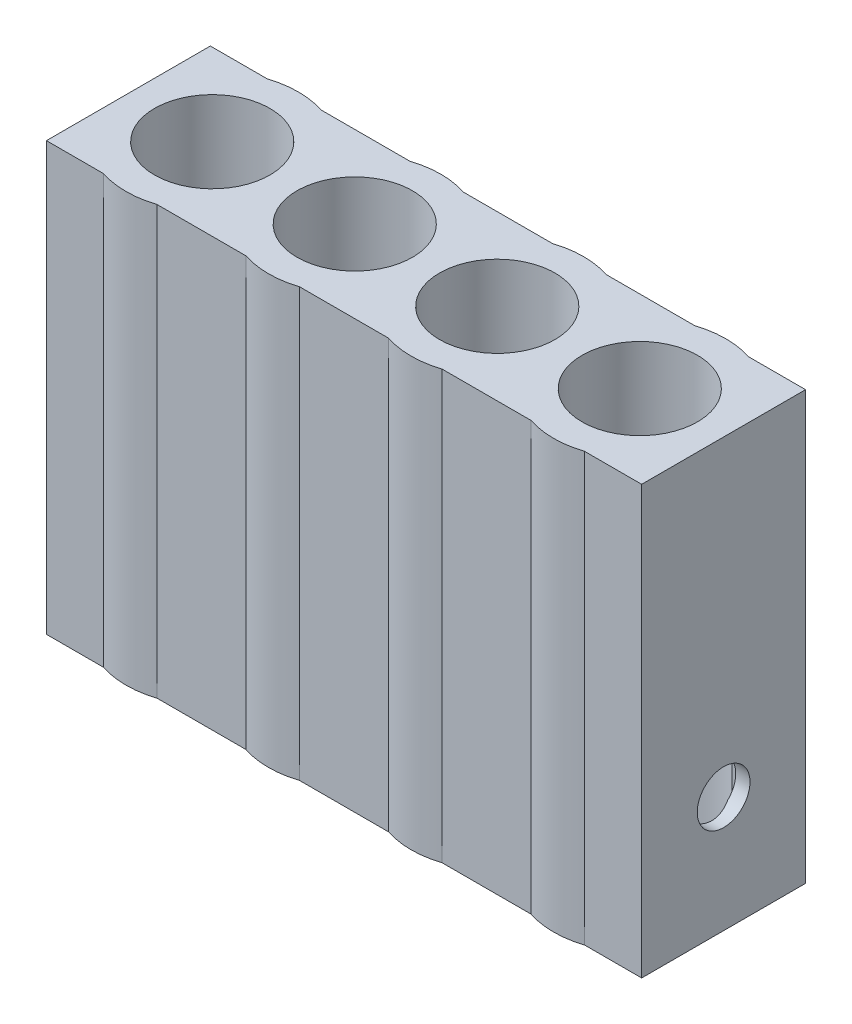
from build123d import *

# Parameters (mm, degrees)
BOSS_EXTRUDE2_DEPTH = 300
CUT_EXTRUDE1_DEPTH  = 200
SKETCH4_R           = 18.503
CUT_EXTRUDE2_DEPTH  = 500
CUT_EXTRUDE3_DEPTH  = 300


with BuildPart() as part:
    # Sketch1 → Boss-Extrude2 (new body)
    with BuildSketch(Plane(origin=(0, 0, 0), x_dir=(1, 0, 0), z_dir=(0, 1, 0))):
        with BuildLine():
            ThreePointArc((39.9, 6.945502142), (43.30489778, 21.11670865), (50, 34.062442661))
            ThreePointArc((50, 34.062442661), (36.348342006, 48.363705745), (18.814887722, 57.5))
            Line((18.814887722, 57.5), (0, 57.5))
            Line((0, 57.5), (0, 40.5))
            ThreePointArc((0, 40.5), (26.066809963, 30.99631298), (39.9, 6.945502142))
        make_face()
        with BuildLine():
            ThreePointArc((0, -40.5), (-40.5, 0), (0, 40.5))
            Line((0, 40.5), (0, 57.5))
            Line((0, 57.5), (-18.814887722, 57.5))
            ThreePointArc((-18.814887722, 57.5), (-44.4487457, 41.04337956), (-58.814340786, 14.181795299))
            Line((-58.814340786, 14.181795299), (-58.814340786, -14.181795299))
            ThreePointArc((-58.814340786, -14.181795299), (-44.4487457, -41.04337956), (-18.814887722, -57.5))
            Line((-18.814887722, -57.5), (0, -57.5))
            Line((0, -57.5), (0, -40.5))
        make_face()
        with BuildLine():
            ThreePointArc((18.814887722, -57.5), (36.348342006, -48.363705745), (50, -34.062442661))
            ThreePointArc((50, -34.062442661), (43.30489778, -21.11670865), (39.9, -6.945502142))
            ThreePointArc((39.9, -6.945502142), (26.066809963, -30.99631298), (0, -40.5))
            Line((0, -40.5), (0, -57.5))
            Line((0, -57.5), (18.814887722, -57.5))
        make_face()
        with BuildLine():
            ThreePointArc((60.1, -6.945502142), (59.650278811, -3.485685012), (59.5, 0))
            Line((59.5, 0), (40.5, 0))
            ThreePointArc((40.5, 0), (40.349721189, -3.485685012), (39.9, -6.945502142))
            ThreePointArc((39.9, -6.945502142), (43.30489778, -21.11670865), (50, -34.062442661))
            ThreePointArc((50, -34.062442661), (56.69510222, -21.11670865), (60.1, -6.945502142))
        make_face()
        with BuildLine():
            Line((40.5, 0), (59.5, 0))
            ThreePointArc((59.5, 0), (59.650278811, 3.485685012), (60.1, 6.945502142))
            ThreePointArc((60.1, 6.945502142), (56.69510222, 21.11670865), (50, 34.062442661))
            ThreePointArc((50, 34.062442661), (43.30489778, 21.11670865), (39.9, 6.945502142))
            ThreePointArc((39.9, 6.945502142), (40.349721189, 3.485685012), (40.5, 0))
        make_face()
        with BuildLine():
            ThreePointArc((139.9, -6.945502142), (100, -40.5), (60.1, -6.945502142))
            ThreePointArc((60.1, -6.945502142), (56.69510222, -21.11670865), (50, -34.062442661))
            ThreePointArc((50, -34.062442661), (63.651657994, -48.363705745), (81.185112278, -57.5))
            Line((81.185112278, -57.5), (118.814887722, -57.5))
            ThreePointArc((118.814887722, -57.5), (136.348342006, -48.363705745), (150, -34.062442661))
            ThreePointArc((150, -34.062442661), (143.30489778, -21.11670865), (139.9, -6.945502142))
        make_face()
        with BuildLine():
            ThreePointArc((50, 34.062442661), (56.69510222, 21.11670865), (60.1, 6.945502142))
            ThreePointArc((60.1, 6.945502142), (100, 40.5), (139.9, 6.945502142))
            ThreePointArc((139.9, 6.945502142), (143.30489778, 21.11670865), (150, 34.062442661))
            ThreePointArc((150, 34.062442661), (136.348342006, 48.363705745), (118.814887722, 57.5))
            Line((118.814887722, 57.5), (81.185112278, 57.5))
            ThreePointArc((81.185112278, 57.5), (63.651657994, 48.363705745), (50, 34.062442661))
        make_face()
        with BuildLine():
            ThreePointArc((150, 34.062442661), (143.30489778, 21.11670865), (139.9, 6.945502142))
            ThreePointArc((139.9, 6.945502142), (140.349721189, 3.485685012), (140.5, 0))
            Line((140.5, 0), (159.5, 0))
            ThreePointArc((159.5, 0), (159.650278811, 3.485685012), (160.1, 6.945502142))
            ThreePointArc((160.1, 6.945502142), (156.69510222, 21.11670865), (150, 34.062442661))
        make_face()
        with BuildLine():
            ThreePointArc((140.5, 0), (140.349721189, -3.485685012), (139.9, -6.945502142))
            ThreePointArc((139.9, -6.945502142), (143.30489778, -21.11670865), (150, -34.062442661))
            ThreePointArc((150, -34.062442661), (156.69510222, -21.11670865), (160.1, -6.945502142))
            ThreePointArc((160.1, -6.945502142), (159.650278811, -3.485685012), (159.5, 0))
            Line((159.5, 0), (140.5, 0))
        make_face()
        with BuildLine():
            ThreePointArc((181.185112278, 57.5), (163.651657994, 48.363705745), (150, 34.062442661))
            ThreePointArc((150, 34.062442661), (156.69510222, 21.11670865), (160.1, 6.945502142))
            ThreePointArc((160.1, 6.945502142), (200, 40.5), (239.9, 6.945502142))
            ThreePointArc((239.9, 6.945502142), (243.30489778, 21.11670865), (250, 34.062442661))
            ThreePointArc((250, 34.062442661), (236.348342006, 48.363705745), (218.814887722, 57.5))
            Line((218.814887722, 57.5), (181.185112278, 57.5))
        make_face()
        with BuildLine():
            ThreePointArc((160.1, -6.945502142), (156.69510222, -21.11670865), (150, -34.062442661))
            ThreePointArc((150, -34.062442661), (163.651657994, -48.363705745), (181.185112278, -57.5))
            Line((181.185112278, -57.5), (218.814887722, -57.5))
            ThreePointArc((218.814887722, -57.5), (236.348342006, -48.363705745), (250, -34.062442661))
            ThreePointArc((250, -34.062442661), (243.30489778, -21.11670865), (239.9, -6.945502142))
            ThreePointArc((239.9, -6.945502142), (200, -40.5), (160.1, -6.945502142))
        make_face()
        with BuildLine():
            ThreePointArc((250, 34.062442661), (243.30489778, 21.11670865), (239.9, 6.945502142))
            ThreePointArc((239.9, 6.945502142), (240.349721189, 3.485685012), (240.5, 0))
            Line((240.5, 0), (259.5, 0))
            ThreePointArc((259.5, 0), (259.650278811, 3.485685012), (260.1, 6.945502142))
            ThreePointArc((260.1, 6.945502142), (256.69510222, 21.11670865), (250, 34.062442661))
        make_face()
        with BuildLine():
            ThreePointArc((240.5, 0), (240.349721189, -3.485685012), (239.9, -6.945502142))
            ThreePointArc((239.9, -6.945502142), (243.30489778, -21.11670865), (250, -34.062442661))
            ThreePointArc((250, -34.062442661), (256.69510222, -21.11670865), (260.1, -6.945502142))
            ThreePointArc((260.1, -6.945502142), (259.650278811, -3.485685012), (259.5, 0))
            Line((259.5, 0), (240.5, 0))
        make_face()
        with BuildLine():
            ThreePointArc((281.185112278, 57.5), (263.651657994, 48.363705745), (250, 34.062442661))
            ThreePointArc((250, 34.062442661), (256.69510222, 21.11670865), (260.1, 6.945502142))
            ThreePointArc((260.1, 6.945502142), (273.933190037, 30.99631298), (300, 40.5))
            Line((300, 40.5), (300, 57.5))
            Line((300, 57.5), (281.185112278, 57.5))
        make_face()
        with BuildLine():
            ThreePointArc((260.1, -6.945502142), (256.69510222, -21.11670865), (250, -34.062442661))
            ThreePointArc((250, -34.062442661), (263.651657994, -48.363705745), (281.185112278, -57.5))
            Line((281.185112278, -57.5), (300, -57.5))
            Line((300, -57.5), (318.814887722, -57.5))
            ThreePointArc((318.814887722, -57.5), (344.4487457, -41.04337956), (358.814340786, -14.181795299))
            Line((358.814340786, -14.181795299), (358.814340786, 14.181795299))
            ThreePointArc((358.814340786, 14.181795299), (344.4487457, 41.04337956), (318.814887722, 57.5))
            Line((318.814887722, 57.5), (300, 57.5))
            Line((300, 57.5), (300, 40.5))
            ThreePointArc((300, 40.5), (328.637824638, 28.637824638), (340.5, 0))
            ThreePointArc((340.5, 0), (303.485685012, -40.349721189), (260.1, -6.945502142))
        make_face()
        with BuildLine():
            ThreePointArc((81.185112278, -57.5), (63.651657994, -48.363705745), (50, -34.062442661))
            ThreePointArc((50, -34.062442661), (36.348342006, -48.363705745), (18.814887722, -57.5))
            Line((18.814887722, -57.5), (81.185112278, -57.5))
        make_face()
        with BuildLine():
            ThreePointArc((181.185112278, -57.5), (163.651657994, -48.363705745), (150, -34.062442661))
            ThreePointArc((150, -34.062442661), (136.348342006, -48.363705745), (118.814887722, -57.5))
            Line((118.814887722, -57.5), (181.185112278, -57.5))
        make_face()
        with BuildLine():
            ThreePointArc((250, -34.062442661), (236.348342006, -48.363705745), (218.814887722, -57.5))
            Line((218.814887722, -57.5), (281.185112278, -57.5))
            ThreePointArc((281.185112278, -57.5), (263.651657994, -48.363705745), (250, -34.062442661))
        make_face()
        with BuildLine():
            ThreePointArc((18.814887722, 57.5), (36.348342006, 48.363705745), (50, 34.062442661))
            ThreePointArc((50, 34.062442661), (63.651657994, 48.363705745), (81.185112278, 57.5))
            Line((81.185112278, 57.5), (18.814887722, 57.5))
        make_face()
        with BuildLine():
            ThreePointArc((118.814887722, 57.5), (136.348342006, 48.363705745), (150, 34.062442661))
            ThreePointArc((150, 34.062442661), (163.651657994, 48.363705745), (181.185112278, 57.5))
            Line((181.185112278, 57.5), (118.814887722, 57.5))
        make_face()
        with BuildLine():
            Line((281.185112278, 57.5), (218.814887722, 57.5))
            ThreePointArc((218.814887722, 57.5), (236.348342006, 48.363705745), (250, 34.062442661))
            ThreePointArc((250, 34.062442661), (263.651657994, 48.363705745), (281.185112278, 57.5))
        make_face()
        with BuildLine():
            ThreePointArc((358.814340786, -14.181795299), (344.4487457, -41.04337956), (318.814887722, -57.5))
            Line((318.814887722, -57.5), (358.814340786, -57.5))
            Line((358.814340786, -57.5), (358.814340786, -14.181795299))
        make_face()
        with BuildLine():
            Line((358.814340786, 57.5), (318.814887722, 57.5))
            ThreePointArc((318.814887722, 57.5), (344.4487457, 41.04337956), (358.814340786, 14.181795299))
            Line((358.814340786, 14.181795299), (358.814340786, 57.5))
        make_face()
        with BuildLine():
            ThreePointArc((-58.814340786, 14.181795299), (-44.4487457, 41.04337956), (-18.814887722, 57.5))
            Line((-18.814887722, 57.5), (-58.814340786, 57.5))
            Line((-58.814340786, 57.5), (-58.814340786, 14.181795299))
        make_face()
        with BuildLine():
            Line((-58.814340786, -57.5), (-18.814887722, -57.5))
            ThreePointArc((-18.814887722, -57.5), (-44.4487457, -41.04337956), (-58.814340786, -14.181795299))
            Line((-58.814340786, -14.181795299), (-58.814340786, -57.5))
        make_face()
        with BuildLine():
            Line((0, 57.5), (18.814887722, 57.5))
            ThreePointArc((18.814887722, 57.5), (0, 60.5), (-18.814887722, 57.5))
            Line((-18.814887722, 57.5), (0, 57.5))
        make_face()
        with BuildLine():
            ThreePointArc((118.814887722, 57.5), (100, 60.5), (81.185112278, 57.5))
            Line((81.185112278, 57.5), (118.814887722, 57.5))
        make_face()
        with BuildLine():
            ThreePointArc((218.814887722, 57.5), (200, 60.5), (181.185112278, 57.5))
            Line((181.185112278, 57.5), (218.814887722, 57.5))
        make_face()
        with BuildLine():
            ThreePointArc((318.814887722, 57.5), (300, 60.5), (281.185112278, 57.5))
            Line((281.185112278, 57.5), (300, 57.5))
            Line((300, 57.5), (318.814887722, 57.5))
        make_face()
        with BuildLine():
            Line((300, -57.5), (281.185112278, -57.5))
            ThreePointArc((281.185112278, -57.5), (300, -60.5), (318.814887722, -57.5))
            Line((318.814887722, -57.5), (300, -57.5))
        make_face()
        with BuildLine():
            Line((218.814887722, -57.5), (181.185112278, -57.5))
            ThreePointArc((181.185112278, -57.5), (200, -60.5), (218.814887722, -57.5))
        make_face()
        with BuildLine():
            Line((118.814887722, -57.5), (81.185112278, -57.5))
            ThreePointArc((81.185112278, -57.5), (100, -60.5), (118.814887722, -57.5))
        make_face()
        with BuildLine():
            ThreePointArc((-18.814887722, -57.5), (0, -60.5), (18.814887722, -57.5))
            Line((18.814887722, -57.5), (0, -57.5))
            Line((0, -57.5), (-18.814887722, -57.5))
        make_face()
        with BuildLine():
            Line((-58.814340786, -14.181795299), (-58.814340786, 14.181795299))
            ThreePointArc((-58.814340786, 14.181795299), (-60.5, 0), (-58.814340786, -14.181795299))
        make_face()
        with BuildLine():
            ThreePointArc((360.5, 0), (360.077107194, 7.140811664), (358.814340786, 14.181795299))
            Line((358.814340786, 14.181795299), (358.814340786, -14.181795299))
            ThreePointArc((358.814340786, -14.181795299), (360.077107194, -7.140811664), (360.5, 0))
        make_face()
    extrude(amount=-BOSS_EXTRUDE2_DEPTH)

    # Sketch2 → Cut-Extrude1 (cut)
    with BuildSketch(Plane.XZ.offset(300)):
        with BuildLine():
            Line((-48.814340786, 47.5), (-48.814340786, 12.938706799))
            ThreePointArc((-48.814340786, 12.938706799), (-50.5, 0), (-48.814340786, -12.938706799))
            Line((-48.814340786, -12.938706799), (-48.814340786, -47.5))
            Line((-48.814340786, -47.5), (-17.146428199, -47.5))
            ThreePointArc((-17.146428199, -47.5), (0, -50.5), (17.146428199, -47.5))
            Line((17.146428199, -47.5), (82.853571801, -47.5))
            ThreePointArc((82.853571801, -47.5), (100, -50.5), (117.146428199, -47.5))
            Line((117.146428199, -47.5), (182.853571801, -47.5))
            ThreePointArc((182.853571801, -47.5), (200, -50.5), (217.146428199, -47.5))
            Line((217.146428199, -47.5), (282.853571801, -47.5))
            ThreePointArc((282.853571801, -47.5), (300, -50.5), (317.146428199, -47.5))
            Line((317.146428199, -47.5), (348.814340786, -47.5))
            Line((348.814340786, -47.5), (348.814340786, -12.938706799))
            ThreePointArc((348.814340786, -12.938706799), (350.5, 0), (348.814340786, 12.938706799))
            Line((348.814340786, 12.938706799), (348.814340786, 47.5))
            Line((348.814340786, 47.5), (317.146428199, 47.5))
            ThreePointArc((317.146428199, 47.5), (300, 50.5), (282.853571801, 47.5))
            Line((282.853571801, 47.5), (217.146428199, 47.5))
            ThreePointArc((217.146428199, 47.5), (200, 50.5), (182.853571801, 47.5))
            Line((182.853571801, 47.5), (117.146428199, 47.5))
            ThreePointArc((117.146428199, 47.5), (100, 50.5), (82.853571801, 47.5))
            Line((82.853571801, 47.5), (17.146428199, 47.5))
            ThreePointArc((17.146428199, 47.5), (0, 50.5), (-17.146428199, 47.5))
            Line((-17.146428199, 47.5), (-48.814340786, 47.5))
        make_face()
    extrude(amount=-CUT_EXTRUDE1_DEPTH, mode=Mode.SUBTRACT)

    # Sketch4 → Cut-Extrude2 (cut, symmetric)
    with BuildSketch(Plane.ZY.offset(58.814340786)):
        with Locations(Location((0, -218.855011971, 0), (0, 0, 39.963012354))):
            Circle(SKETCH4_R)
    extrude(amount=CUT_EXTRUDE2_DEPTH, both=True, mode=Mode.SUBTRACT)

    # Sketch8 → Cut-Extrude3 (cut)
    with BuildSketch(Plane(origin=(0, 0, 0), x_dir=(1, 0, 0), z_dir=(0, 1, 0))):
        with BuildLine():
            Line((-58.814340786, 14.181795299), (-58.814340786, -14.181795299))
            ThreePointArc((-58.814340786, -14.181795299), (-60.5, 0), (-58.814340786, 14.181795299))
        make_face()
        with BuildLine():
            Line((358.814340786, 14.181795299), (358.814340786, -14.181795299))
            ThreePointArc((358.814340786, -14.181795299), (360.5, 0), (358.814340786, 14.181795299))
        make_face()
    extrude(amount=-CUT_EXTRUDE3_DEPTH, mode=Mode.SUBTRACT)


solid = part.part
